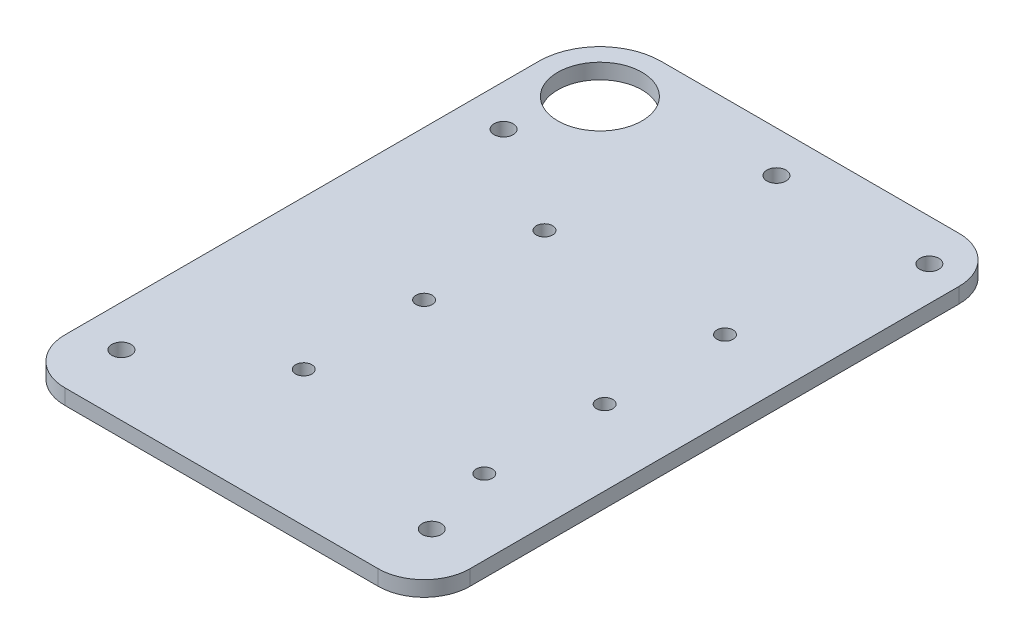
from build123d import *

# Parameters (mm, degrees)
SKETCH1_R           = 3.175
SKETCH1_R_2         = 2.7
SKETCH1_R_3         = 14
BOSS_EXTRUDE1_DEPTH = 5.08
FILLET1_R           = 15.24


with BuildPart() as part:
    # Sketch1 → Boss-Extrude1 (new body)
    with BuildSketch(Plane(origin=(0, 0, 0), x_dir=(1, 0, 0), z_dir=(0, 1, 0))):
        with BuildLine():
            Line((114.3, 20.32), (0, 20.32))
            ThreePointArc((0, 20.32), (-14.368409794, 14.368409794), (-20.32, 0))
            Line((-20.32, 0), (-20.32, -172.72))
            Line((-20.32, -172.72), (114.3, -172.72))
            Line((114.3, -172.72), (114.3, 20.32))
        make_face()
        with Locations(Location((-6.604, -152.4, 0), (0, 0, 270))):
            Circle(SKETCH1_R, mode=Mode.SUBTRACT)
        with Locations(Location((29.297861909, -127.72, 0), (0, 0, 270))):
            Circle(SKETCH1_R_2, mode=Mode.SUBTRACT)
        with Locations(Location((29.297861909, -87.72, 0), (0, 0, 270))):
            Circle(SKETCH1_R_2, mode=Mode.SUBTRACT)
        with Locations(Location((96.52, -152.4, 0), (0, 0, 270))):
            Circle(SKETCH1_R, mode=Mode.SUBTRACT)
        with Locations(Location((89.297861909, -127.72, 0), (0, 0, 270))):
            Circle(SKETCH1_R_2, mode=Mode.SUBTRACT)
        with Locations(Location((89.297861909, -87.72, 0), (0, 0, 270))):
            Circle(SKETCH1_R_2, mode=Mode.SUBTRACT)
        with Locations(Location((29.297861909, -47.72, 0), (0, 0, 270))):
            Circle(SKETCH1_R_2, mode=Mode.SUBTRACT)
        with Locations(Location((-6.604, -25.4, 0), (0, 0, 270))):
            Circle(SKETCH1_R, mode=Mode.SUBTRACT)
        with Locations(Location((89.297861909, -47.72, 0), (0, 0, 270))):
            Circle(SKETCH1_R_2, mode=Mode.SUBTRACT)
        with Locations(Location((52.07, 6.604, 0), (0, 0, 270))):
            Circle(SKETCH1_R, mode=Mode.SUBTRACT)
        with Locations(Location((102.87, 6.604, 0), (0, 0, 270))):
            Circle(SKETCH1_R, mode=Mode.SUBTRACT)
        with Locations(Location((0, 0, 0), (0, 0, 270))):
            Circle(SKETCH1_R_3, mode=Mode.SUBTRACT)
    extrude(amount=BOSS_EXTRUDE1_DEPTH)

    # Fillet1
    fillet1_edges = [part.edges().sort_by_distance(p)[0] for p in [
        (114.3, 2.54, -20.32),
        (114.3, 2.54, 172.72),
        (-20.32, 2.54, 172.72),
    ]]
    fillet(fillet1_edges, radius=FILLET1_R)


solid = part.part
